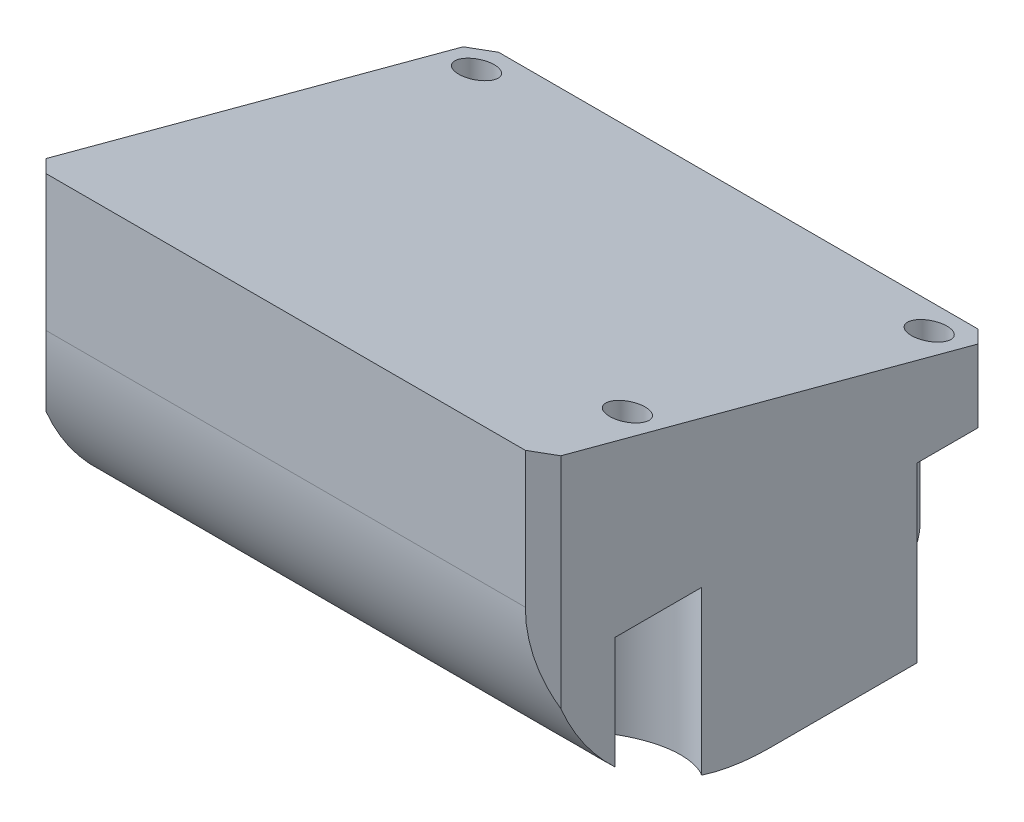
from build123d import *

# Parameters (mm, degrees)
BOSS_EXTRUDE1_DEPTH                                = 11
BOSS_EXTRUDE2_DEPTH                                = 36
BOSS_EXTRUDE3_DEPTH                                = 11
CUT_EXTRUDE1_DEPTH                                 = 19.5
CUT_EXTRUDE2_DEPTH                                 = 19.5
F_3_9_3_9_DIAMETER_HOLE1_D                         = 3.9
F_3_9_3_9_DIAMETER_HOLE1_DEPTH                     = 30
F_3_9_3_9_DIAMETER_HOLE1_TIP                       = 1.171678207
CBORE_FOR_M3_5_HEX_HEAD_MACHINE_SCREW1_D           = 4
CBORE_FOR_M3_5_HEX_HEAD_MACHINE_SCREW1_DEPTH       = 40.80674334
CBORE_FOR_M3_5_HEX_HEAD_MACHINE_SCREW1_CBORE_D     = 12
CBORE_FOR_M3_5_HEX_HEAD_MACHINE_SCREW1_CBORE_DEPTH = 19.5
F_4_0_4_DIAMETER_HOLE1_D                           = 4
F_4_0_4_DIAMETER_HOLE1_DEPTH                       = 21.30674334
CHAMFER1_SIZE                                      = 2
FILLET4_R                                          = 5
FILLET5_R                                          = 6
CUT_EXTRUDE3_DEPTH                                 = 141.586272594


with BuildPart() as part:
    # Sketch1 → Boss-Extrude1 (new body)
    with BuildSketch(Plane(origin=(-29, 0, 0), x_dir=(0, -1, 0), z_dir=(-1, 0, 0))):
        Polygon((125.5, 25.5), (84.69325666, 25.5), (98.358665474, -25.5), (125.5, -25.5), align=None)
    extrude(amount=-BOSS_EXTRUDE1_DEPTH)

    # Sketch2 → Boss-Extrude2 (add)
    with BuildSketch(Plane(origin=(-18, 0, 0), x_dir=(0, 0, -1), z_dir=(1, 0, 0))):
        Polygon((25.5, -107.179491924), (15.5, -104.5), (9.873066959, -125.5), (-25.5, -125.5), (-25.5, -84.69325666), (25.5, -98.358665474), align=None)
    extrude(amount=BOSS_EXTRUDE2_DEPTH)

    # Sketch3 → Boss-Extrude3 (add)
    with BuildSketch(Plane(origin=(18, 0, 0), x_dir=(0, 0, -1), z_dir=(1, 0, 0))):
        Polygon((-25.5, -125.5), (-25.5, -84.69325666), (25.5, -98.358665474), (25.5, -125.5), align=None)
    extrude(amount=BOSS_EXTRUDE3_DEPTH)

    # Sketch4 → Cut-Extrude1 (cut)
    with BuildSketch(Plane.XZ.offset(125.5)):
        with BuildLine():
            Line((29, -25.5), (29, -16.626602828))
            ThreePointArc((29, -16.626602828), (21.350933194, -17.165805191), (20.478555895, -24.784067463))
            Line((20.478555895, -24.784067463), (20.478555895, -25.5))
            Line((20.478555895, -25.5), (29, -25.5))
        make_face()
    extrude(amount=-CUT_EXTRUDE1_DEPTH, mode=Mode.SUBTRACT)

    # Sketch5 → Cut-Extrude2 (cut)
    with BuildSketch(Plane.XZ.offset(125.5)):
        with BuildLine():
            Line((-20.478555895, -25.5), (-20.478555895, -24.784067463))
            ThreePointArc((-20.478555895, -24.784067463), (-21.350933194, -17.165805191), (-29, -16.626602828))
            Line((-29, -16.626602828), (-29, -25.5))
            Line((-29, -25.5), (-20.478555895, -25.5))
        make_face()
    extrude(amount=-CUT_EXTRUDE2_DEPTH, mode=Mode.SUBTRACT)

    # Ø3.9 (3.9) Diameter Hole1
    with Locations(Plane(origin=(0, -10.875172652, -40.586696879), x_dir=(-1, 0, 0), z_dir=(0, -0.25881904510251963, -0.9659258262890685))):
        with Locations((0, -111.918353437), (-11, -111.918353437), (-5.5, -104.418353437), (5.5, -104.418353437), (11, -111.918353437)):
            Hole(F_3_9_3_9_DIAMETER_HOLE1_D / 2, depth=F_3_9_3_9_DIAMETER_HOLE1_DEPTH)
            with Locations((0, 0, -(F_3_9_3_9_DIAMETER_HOLE1_DEPTH + F_3_9_3_9_DIAMETER_HOLE1_TIP / 2))):  # 118° drill point
                Cone(0, F_3_9_3_9_DIAMETER_HOLE1_D / 2, F_3_9_3_9_DIAMETER_HOLE1_TIP, mode=Mode.SUBTRACT)

    # CBORE for M3.5 Hex Head Machine Screw1
    with Locations(Plane(origin=(0, -125.5, 0), x_dir=(-1, 0, 0), z_dir=(0, -1, 0))):
        with Locations((-25.5, -12.5)):
            CounterBoreHole(CBORE_FOR_M3_5_HEX_HEAD_MACHINE_SCREW1_D / 2, CBORE_FOR_M3_5_HEX_HEAD_MACHINE_SCREW1_CBORE_D / 2, CBORE_FOR_M3_5_HEX_HEAD_MACHINE_SCREW1_CBORE_DEPTH, depth=CBORE_FOR_M3_5_HEX_HEAD_MACHINE_SCREW1_DEPTH)

    # Ø4.0 (4) Diameter Hole1
    with Locations(Plane(origin=(0, -106, 0), x_dir=(-1, 0, 0), z_dir=(0, -1, 0))):
        with Locations((25.5, 21.5), (-25.5, 21.5)):
            Hole(F_4_0_4_DIAMETER_HOLE1_D / 2, depth=F_4_0_4_DIAMETER_HOLE1_DEPTH)

    # Chamfer1
    chamfer1_edges = [part.edges().sort_by_distance(p)[0] for p in [
        (29, -105.09662833, 25.5),
        (29, -102.179332737, -25.5),
        (-29, -102.179332737, -25.5),
        (-29, -105.09662833, 25.5),
        (-29, -125.5, 4.436698586),
    ]]
    chamfer(chamfer1_edges, length=CHAMFER1_SIZE)

    # Fillet4
    fillet4_edges = [part.edges().sort_by_distance(p)[0] for p in [
        (19.239277947, -125.5, -25.5),
        (-19.239277947, -125.5, -25.5),
    ]]
    fillet(fillet4_edges, radius=FILLET4_R)

    # Fillet5
    fillet5_edges = [part.edges().sort_by_distance(p)[0] for p in [
        (-18, -105.839745962, -20.5),
        (18, -105.839745962, -20.5),
    ]]
    fillet(fillet5_edges, radius=FILLET5_R)

    # Sketch12 → Cut-Extrude3 (cut, through all)
    with BuildSketch(Plane(origin=(29, 0, 0), x_dir=(0, 0, -1), z_dir=(1, 0, 0))):
        with BuildLine():
            Line((0, -125.5), (-25.5, -125.5))
            Line((-25.5, -125.5), (-25.5, -100))
            ThreePointArc((-25.5, -100), (-18.03122292, -118.03122292), (0, -125.5))
        make_face()
    extrude(amount=-CUT_EXTRUDE3_DEPTH, mode=Mode.SUBTRACT)


solid = part.part
